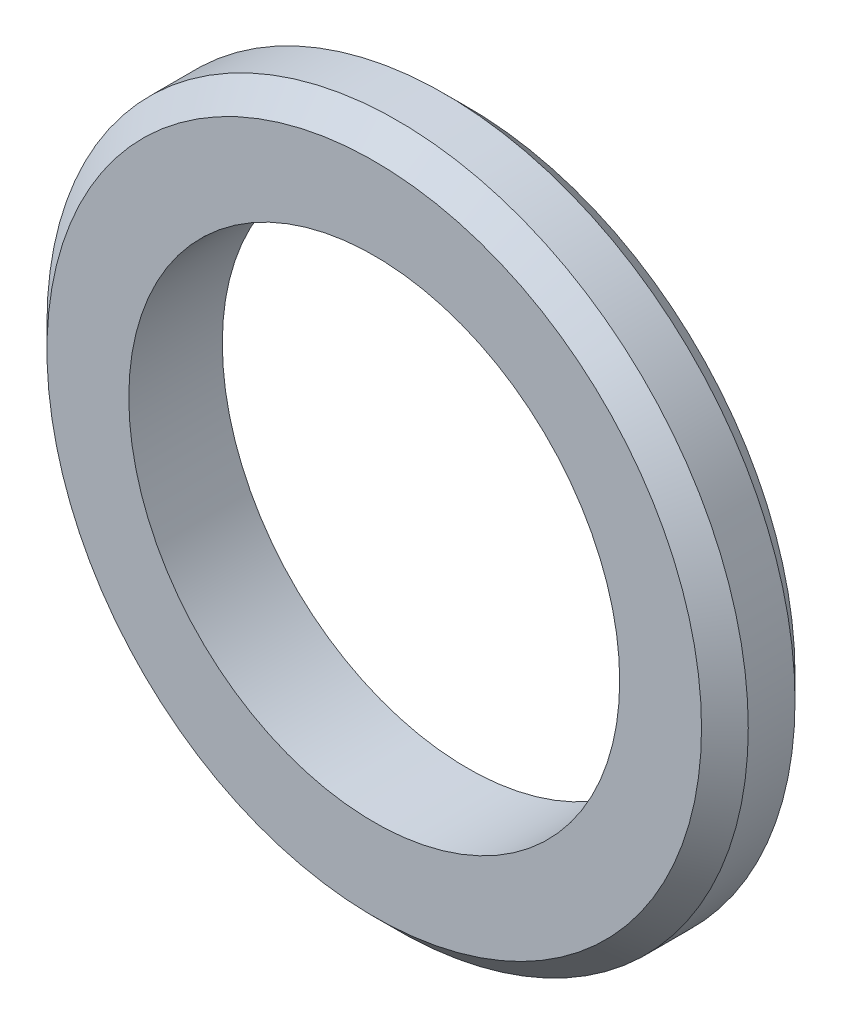
from build123d import *

# Parameters (mm, degrees)
SKETCH1_R           = 7.5
SKETCH1_R_2         = 5.25
BOSS_EXTRUDE1_DEPTH = 1
CHAMFER1_SIZE       = 0.5


with BuildPart() as part:
    # Sketch1 → Boss-Extrude1 (new, symmetric)
    with BuildSketch(Plane.XY):
        Circle(SKETCH1_R)
        Circle(SKETCH1_R_2, mode=Mode.SUBTRACT)
    extrude(amount=BOSS_EXTRUDE1_DEPTH, both=True)

    # Chamfer1
    chamfer1_edges = [part.edges().sort_by_distance(p)[0] for p in [
        (-7.5, 0, -1),
        (-7.5, 0, 1),
    ]]
    chamfer(chamfer1_edges, length=CHAMFER1_SIZE)


solid = part.part
